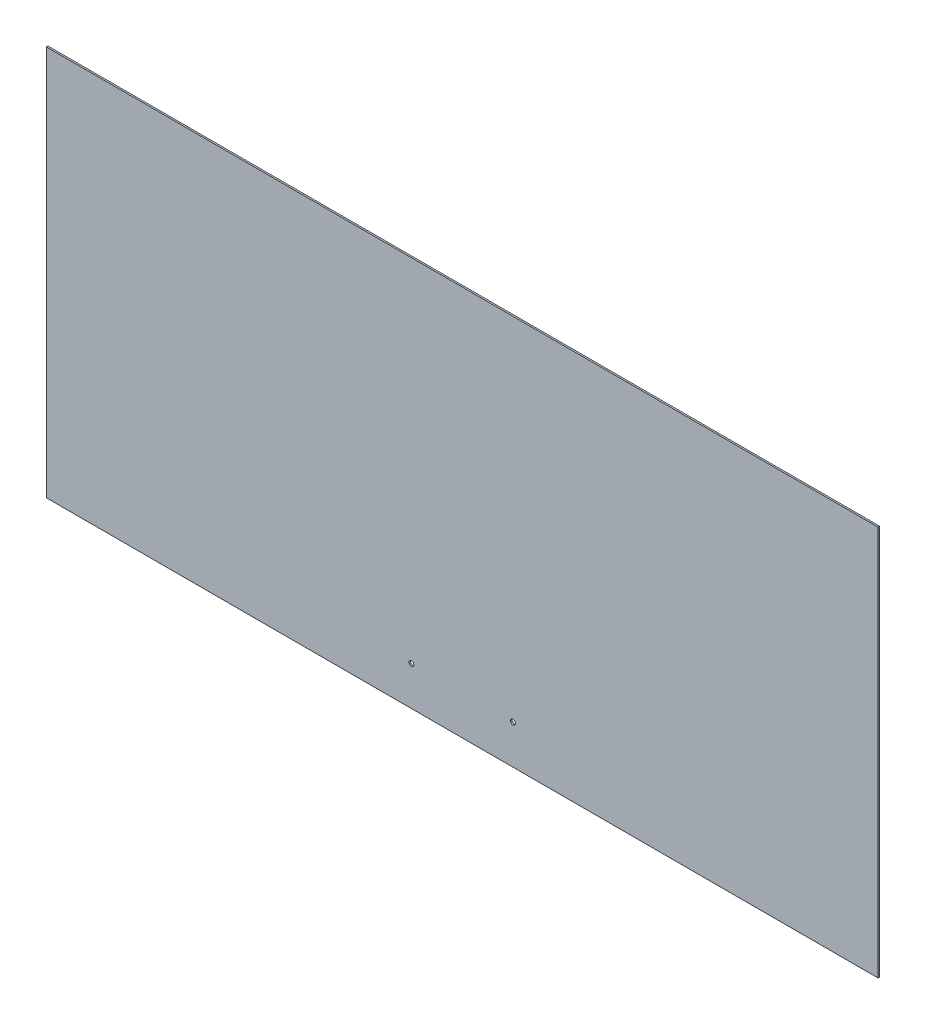
from build123d import *

# Parameters (mm, degrees)
SKETCH1_W           = 1065
SKETCH1_H           = 500
BOSS_EXTRUDE1_DEPTH = 2
SKETCH2_R           = 3.1
CUT_EXTRUDE1_DEPTH  = 1177.532617482


with BuildPart() as part:
    # Sketch1 → Boss-Extrude1 (new body)
    with BuildSketch(Plane.XY):
        with Locations((532.5, -250)):
            Rectangle(SKETCH1_W, SKETCH1_H)
    extrude(amount=BOSS_EXTRUDE1_DEPTH)

    # Sketch2 → Cut-Extrude1 (cut, through all)
    with BuildSketch(Plane.XY.offset(2)):
        with Locations((597.5, -450)):
            Circle(SKETCH2_R)
        with Locations((467.5, -450)):
            Circle(SKETCH2_R)
    extrude(amount=-CUT_EXTRUDE1_DEPTH, mode=Mode.SUBTRACT)


solid = part.part
